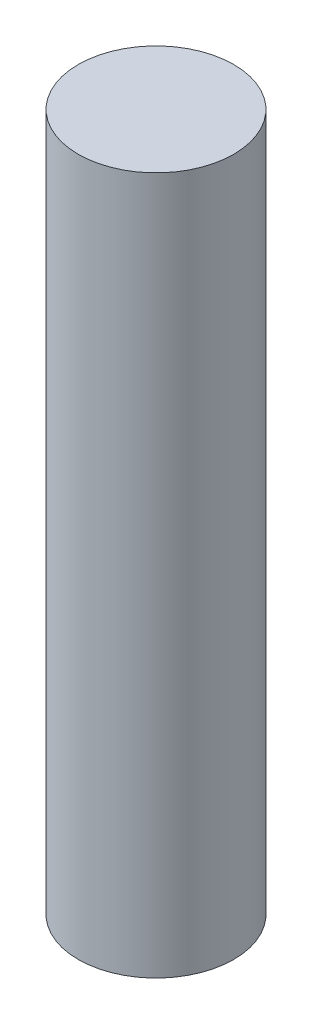
from build123d import *

# Parameters (mm, degrees)
CROQUIS1_R              = 564.2
SALIENTE_EXTRUIR1_DEPTH = 5060


with BuildPart() as part:
    # Croquis1 → Saliente-Extruir1 (new body)
    with BuildSketch(Plane(origin=(0, 0, 0), x_dir=(1, 0, 0), z_dir=(0, 1, 0))):
        with Locations(Location((0, 0, 0), (0, 0, 270))):
            Circle(CROQUIS1_R)
    extrude(amount=SALIENTE_EXTRUIR1_DEPTH)


solid = part.part
